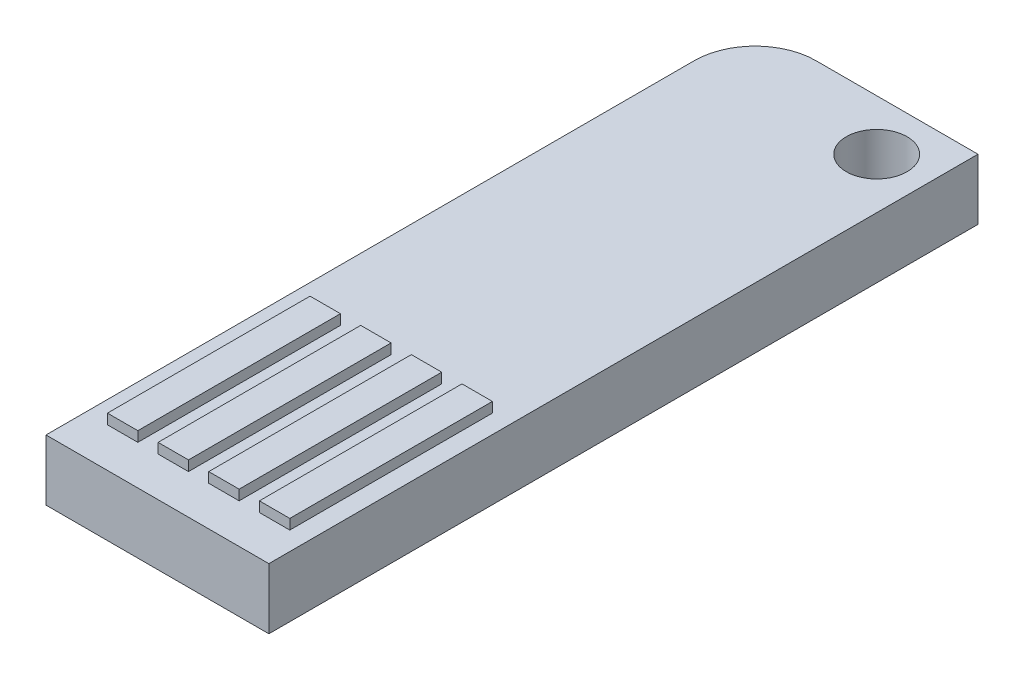
from build123d import *

# Parameters (mm, degrees)
SKETCH1_W           = 11
SKETCH1_H           = 35
BOSS_EXTRUDE1_DEPTH = 3
SKETCH2_R           = 1.5
CUT_EXTRUDE1_DEPTH  = 3
FILLET1_R           = 3
SKETCH3_W           = 1.5
SKETCH3_H           = 10
BOSS_EXTRUDE2_DEPTH = 0.5


with BuildPart() as part:
    # Sketch1 → Boss-Extrude1 (new body)
    with BuildSketch(Plane(origin=(0, 0, 0), x_dir=(1, 0, 0), z_dir=(0, 1, 0))):
        Rectangle(SKETCH1_W, SKETCH1_H)
    extrude(amount=BOSS_EXTRUDE1_DEPTH)

    # Sketch2 → Cut-Extrude1 (cut)
    with BuildSketch(Plane(origin=(0, 3, 0), x_dir=(1, 0, 0), z_dir=(0, 1, 0))):
        with Locations(Location((3, 15, 0), (0, 0, 270))):
            Circle(SKETCH2_R)
    extrude(amount=-CUT_EXTRUDE1_DEPTH, mode=Mode.SUBTRACT)

    # Fillet1
    fillet1_edges = [part.edges().sort_by_distance(p)[0] for p in [
        (-5.5, 1.5, -17.5),
    ]]
    fillet(fillet1_edges, radius=FILLET1_R)

    # Sketch3 → Boss-Extrude2 (add)
    with BuildSketch(Plane(origin=(0, 3, 0), x_dir=(1, 0, 0), z_dir=(0, 1, 0))):
        with Locations((-1.167481663, -10.550122249)):
            Rectangle(SKETCH3_W, SKETCH3_H)
        with Locations((-3.667481663, -10.550122249)):
            Rectangle(SKETCH3_W, SKETCH3_H)
        with Locations((1.332518337, -10.550122249)):
            Rectangle(SKETCH3_W, SKETCH3_H)
        with Locations((3.832518337, -10.550122249)):
            Rectangle(SKETCH3_W, SKETCH3_H)
    extrude(amount=BOSS_EXTRUDE2_DEPTH)


solid = part.part
